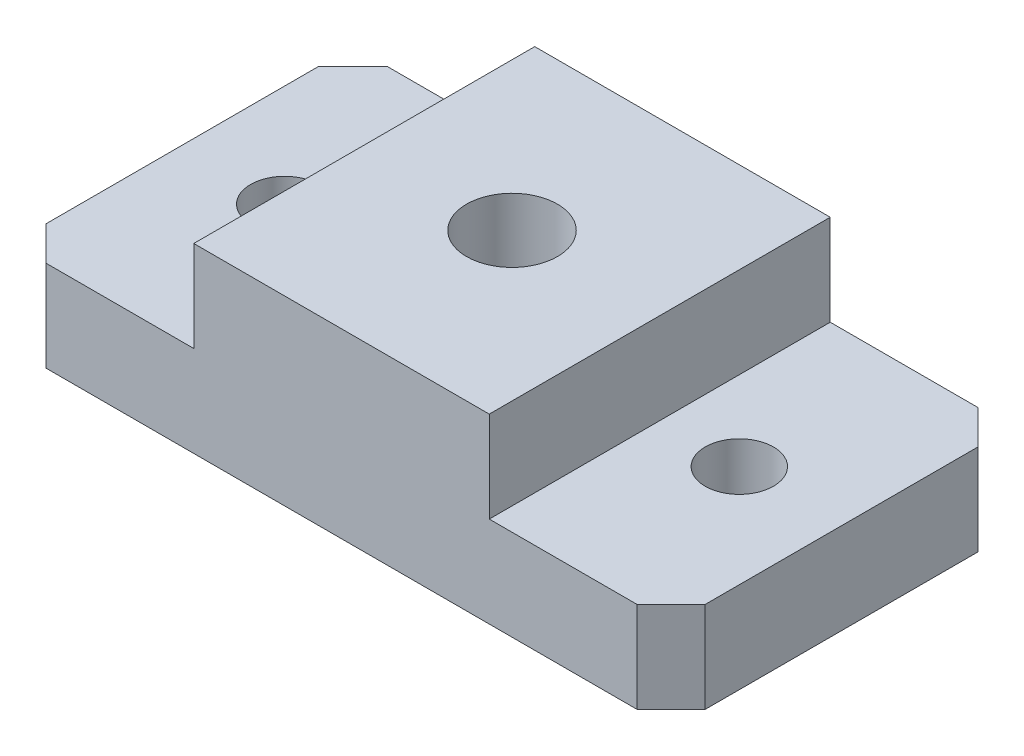
from build123d import *

# Parameters (mm, degrees)
SKETCH1_W           = 58
SKETCH1_H           = 30
SKETCH1_R           = 3
BOSS_EXTRUDE1_DEPTH = 8
SKETCH2_W           = 26
SKETCH2_H           = 30
BOSS_EXTRUDE2_DEPTH = 8
SKETCH3_R           = 4
CUT_EXTRUDE1_DEPTH  = 37.359317925
CHAMFER1_SIZE       = 3


with BuildPart() as part:
    # Sketch1 → Boss-Extrude1 (new body)
    with BuildSketch(Plane(origin=(0, 0, 0), x_dir=(1, 0, 0), z_dir=(0, 1, 0))):
        Rectangle(SKETCH1_W, SKETCH1_H)
        with Locations(Location((-20, 0, 0), (0, 0, 270))):
            Circle(SKETCH1_R, mode=Mode.SUBTRACT)
        with Locations(Location((20, 0, 0), (0, 0, 270))):
            Circle(SKETCH1_R, mode=Mode.SUBTRACT)
    extrude(amount=BOSS_EXTRUDE1_DEPTH)

    # Sketch2 → Boss-Extrude2 (add)
    with BuildSketch(Plane(origin=(0, 8, 0), x_dir=(1, 0, 0), z_dir=(0, 1, 0))):
        Rectangle(SKETCH2_W, SKETCH2_H)
    extrude(amount=BOSS_EXTRUDE2_DEPTH)

    # Sketch3 → Cut-Extrude1 (cut, through all)
    with BuildSketch(Plane(origin=(0, 16, 0), x_dir=(1, 0, 0), z_dir=(0, 1, 0))):
        with Locations(Location((0, 0, 0), (0, 0, 270))):
            Circle(SKETCH3_R)
    extrude(amount=-CUT_EXTRUDE1_DEPTH, mode=Mode.SUBTRACT)

    # Chamfer1
    chamfer1_edges = [part.edges().sort_by_distance(p)[0] for p in [
        (29, 4, 15),
        (-29, 4, 15),
        (-29, 4, -15),
        (29, 4, -15),
    ]]
    chamfer(chamfer1_edges, length=CHAMFER1_SIZE)


solid = part.part
